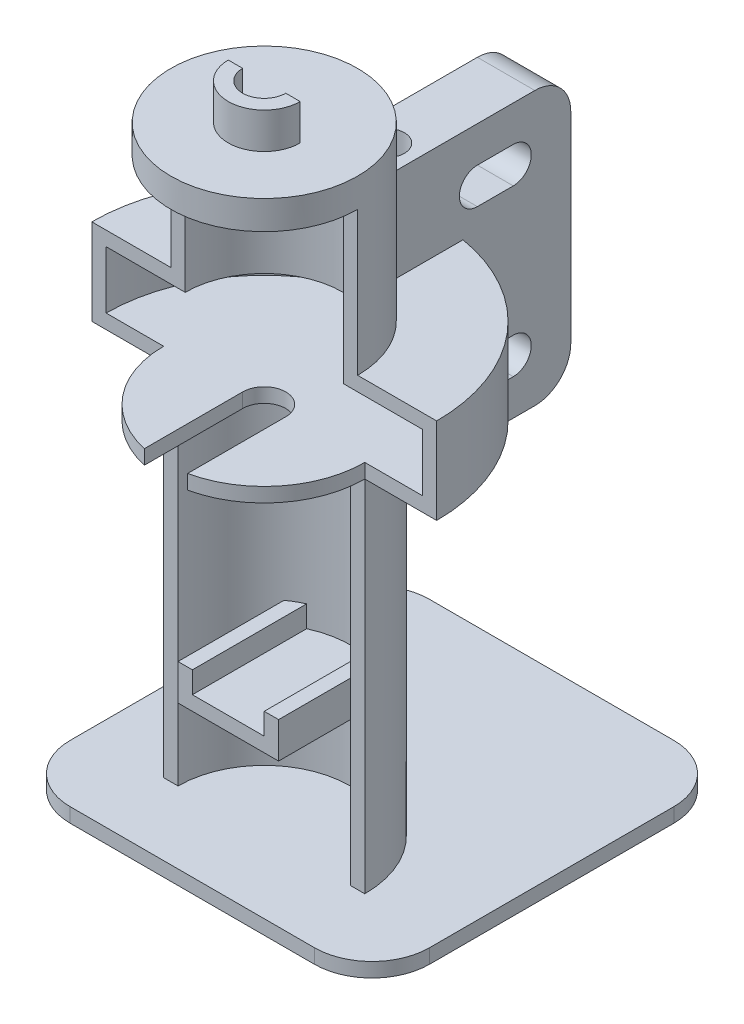
from build123d import *

# Parameters (mm, degrees)
MOTOR_FRONTPLATE_DEPTH           = 2
MOTORKRYBBE_START                = 50
MOTORKRYBBE_DEPTH                = 50
SKYGGE_KAPPE_DEPTH               = 8
SKYGGE_TOPP_DEPTH                = 2
LEDHOLDER_TOPP_DEPTH             = 13
LEDHOLDER_START                  = 13
LEDHOLDER_BUNN_DEPTH             = 13
SKETCH10_R                       = 2.5
LEDHULL_DEPTH                    = 51.950956811
ROTORKAPPE_VEGG_DEPTH            = 20
SKETCH12_R                       = 13
LASERHOLDER_DEPTH                = 4
LASER_HULL_D                     = 6
BUNNPLATE_DEPTH                  = 2
BOSS_EXTRUDE12_DEPTH             = 5
BOSS_EXTRUDE12_DIRECTION_2_REACH = 72.207
LED_START                        = -38
LED_KABELHOLDER_DEPTH            = 38
KABELHOLDER_HULL_REACH           = 73.729
FILLET1_R                        = 5
BOSS_EXTRUDE14_DEPTH             = 5


with BuildPart() as part:
    # Sketch1 → Motor-frontplate (new body)
    with BuildSketch(Plane(origin=(0, 0, 0), x_dir=(1, 0, 0), z_dir=(0, 1, 0))):
        with BuildLine():
            ThreePointArc((-3, 0), (0, 3), (3, 0))
            Line((3, 0), (3, -13.674794331))
            ThreePointArc((3, -13.674794331), (10.908712115, -8.774964387), (14, 0))
            ThreePointArc((14, 0), (0, 14), (-14, 0))
            ThreePointArc((-14, 0), (-10.908712115, -8.774964387), (-3, -13.674794331))
            Line((-3, -13.674794331), (-3, 0))
        make_face()
        with BuildLine():
            Line((14, 0), (24, 0))
            ThreePointArc((24, 0), (0, 24), (-24, 0))
            Line((-24, 0), (-14, 0))
            ThreePointArc((-14, 0), (0, 14), (14, 0))
        make_face()
    extrude(amount=MOTOR_FRONTPLATE_DEPTH)

    # Sketch2 → Motorkrybbe (add)
    with BuildSketch(Plane.XZ.offset(MOTORKRYBBE_START)):
        with BuildLine():
            Line((-12, 0), (-14, 0))
            ThreePointArc((-14, 0), (0, -14), (14, 0))
            Line((14, 0), (12, 0))
            ThreePointArc((12, 0), (0, -12), (-12, 0))
        make_face()
    extrude(amount=-MOTORKRYBBE_DEPTH)

    # Sketch5 → Skygge - Kappe (add)
    with BuildSketch(Plane(origin=(0, 2, 0), x_dir=(1, 0, 0), z_dir=(0, 1, 0))):
        with BuildLine():
            Line((-24, 0), (-22, 0))
            ThreePointArc((-22, 0), (0, 22), (22, 0))
            Line((22, 0), (24, 0))
            ThreePointArc((24, 0), (0, 24), (-24, 0))
        make_face()
    extrude(amount=SKYGGE_KAPPE_DEPTH)

    # Sketch6 → Skygge - Topp (add)
    with BuildSketch(Plane(origin=(0, 10, 0), x_dir=(1, 0, 0), z_dir=(0, 1, 0))):
        with BuildLine():
            Line((-24, 0), (-11, 0))
            ThreePointArc((-11, 0), (0, 11), (11, 0))
            Line((11, 0), (24, 0))
            ThreePointArc((24, 0), (0, 24), (-24, 0))
        make_face()
    extrude(amount=SKYGGE_TOPP_DEPTH)

    # Sketch7 → LEDholder - Topp (add)
    with BuildSketch(Plane(origin=(0, 12, 0), x_dir=(1, 0, 0), z_dir=(0, 1, 0))):
        with BuildLine():
            Line((-4, 12.369316877), (-4, 23.664319132))
            ThreePointArc((-4, 23.664319132), (0, 24), (4, 23.664319132))
            Line((4, 23.664319132), (4, 12.369316877))
            ThreePointArc((4, 12.369316877), (0, 13), (-4, 12.369316877))
        make_face()
    extrude(amount=LEDHOLDER_TOPP_DEPTH)

    # Sketch8 → LEDholder - Bunn (add)
    with BuildSketch(Plane.XZ.offset(LEDHOLDER_START)):
        with BuildLine():
            ThreePointArc((-4, -23.664319132), (0, -24), (4, -23.664319132))
            Line((4, -23.664319132), (4, -13.416407865))
            ThreePointArc((4, -13.416407865), (0, -14), (-4, -13.416407865))
            Line((-4, -13.416407865), (-4, -23.664319132))
        make_face()
    extrude(amount=-LEDHOLDER_BUNN_DEPTH)

    # Sketch10 → LEDhull (cut, through all)
    with BuildSketch(Plane.XZ.offset(13)):
        with Locations(Location((0, -17, 0), (0, 0, 270))):
            Circle(SKETCH10_R)
    extrude(amount=-LEDHULL_DEPTH, mode=Mode.SUBTRACT)

    # Sketch11 → Rotorkappe - Vegg (add)
    with BuildSketch(Plane(origin=(0, 12, 0), x_dir=(1, 0, 0), z_dir=(0, 1, 0))):
        with BuildLine():
            Line((-13, 0), (-11, 0))
            ThreePointArc((-11, 0), (0, 11), (11, 0))
            Line((11, 0), (13, 0))
            ThreePointArc((13, 0), (0, 13), (-13, 0))
        make_face()
    extrude(amount=ROTORKAPPE_VEGG_DEPTH)

    # Sketch12 → Laserholder (add)
    with BuildSketch(Plane(origin=(0, 32, 0), x_dir=(1, 0, 0), z_dir=(0, 1, 0))):
        with Locations(Location((0, 0, 0), (0, 0, 107.920213139))):
            Circle(SKETCH12_R)
    extrude(amount=LASERHOLDER_DEPTH)

    # Laser - hull (through all)
    with Locations(Plane(origin=(0, 36, 0), x_dir=(1, 0, 0), z_dir=(0, 1, 0))):
        with Locations((0, 0)):
            Hole(LASER_HULL_D / 2)

    # Sketch16 → Bunnplate (add)
    with BuildSketch(Plane.XZ.offset(50)):
        with BuildLine():
            Line((-17, -40), (17, -40))
            ThreePointArc((17, -40), (22.656854249, -37.656854249), (25, -32))
            Line((25, -32), (25, 2))
            ThreePointArc((25, 2), (22.656854249, 7.656854249), (17, 10))
            Line((17, 10), (-17, 10))
            ThreePointArc((-17, 10), (-22.656854249, 7.656854249), (-25, 2))
            Line((-25, 2), (-25, -32))
            ThreePointArc((-25, -32), (-22.656854249, -37.656854249), (-17, -40))
        make_face()
    extrude(amount=BUNNPLATE_DEPTH)

    # Sketch19 → Boss-Extrude12 (add)
    with BuildSketch(Plane.XY):
        Polygon((0, -33), (-5, -33), (-5, -30), (-7, -30), (-7, -35), (0, -35), align=None)
    boss_extrude12 = extrude(amount=BOSS_EXTRUDE12_DEPTH)

    # Sketch19 → Boss-Extrude12 direction 2 (add, up to next)
    with BuildSketch(Plane.XY, mode=Mode.PRIVATE) as boss_extrude12_direction_2_sk1:
        Polygon((0, -33), (-5, -33), (-5, -30), (-7, -30), (-7, -35), (0, -35), align=None)
    boss_extrude12_direction_2_tool1 = extrude(boss_extrude12_direction_2_sk1.sketch, amount=-BOSS_EXTRUDE12_DIRECTION_2_REACH, mode=Mode.PRIVATE) - part.part
    boss_extrude12_direction_2 = boss_extrude12_direction_2_tool1.solids().sort_by_distance((-4.25, -33.25, 0))[0]
    add(boss_extrude12_direction_2)

    # Mirror2: Boss-Extrude12, Boss-Extrude12 direction 2 across plane
    add(boss_extrude12.mirror(Plane(origin=(0, -35, -40.002), x_dir=(0, 0, 1), z_dir=(1, 0, 0))))
    add(boss_extrude12_direction_2.mirror(Plane(origin=(0, -35, -40.002), x_dir=(0, 0, 1), z_dir=(1, 0, 0))))

    # Sketch20 → LED - kabelholder (add)
    with BuildSketch(Plane(origin=(0, 25, 0), x_dir=(1, 0, 0), z_dir=(0, 1, 0)).offset(LED_START)):
        with BuildLine():
            Line((4, 23.664319132), (4, 38.664319132))
            Line((4, 38.664319132), (-4, 38.664319132))
            Line((-4, 38.664319132), (-4, 23.664319132))
            ThreePointArc((-4, 23.664319132), (0, 24), (4, 23.664319132))
        make_face()
    extrude(amount=LED_KABELHOLDER_DEPTH)

    # Sketch21 → Kabelholder - hull (cut, up to next)
    with BuildSketch(Plane(origin=(4, 0, 0), x_dir=(0, 0, -1), z_dir=(1, 0, 0)), mode=Mode.PRIVATE) as kabelholder_hull_sk1:
        with BuildLine():
            Line((25.664319132, 15), (30.664319132, 15))
            ThreePointArc((30.664319132, 15), (33.164319132, 17.5), (30.664319132, 20))
            Line((30.664319132, 20), (25.664319132, 20))
            ThreePointArc((25.664319132, 20), (23.164319132, 17.5), (25.664319132, 15))
        make_face()
    kabelholder_hull_tool1 = extrude(kabelholder_hull_sk1.sketch, amount=-KABELHOLDER_HULL_REACH, mode=Mode.PRIVATE) & part.part
    # Sketch21 → Kabelholder - hull (cut, up to next)
    with BuildSketch(Plane(origin=(4, 0, 0), x_dir=(0, 0, -1), z_dir=(1, 0, 0)), mode=Mode.PRIVATE) as kabelholder_hull_sk2:
        with BuildLine():
            ThreePointArc((30.664319132, -3), (33.164319132, -5.5), (30.664319132, -8))
            Line((30.664319132, -8), (25.664319132, -8))
            ThreePointArc((25.664319132, -8), (23.164319132, -5.5), (25.664319132, -3))
            Line((25.664319132, -3), (30.664319132, -3))
        make_face()
    kabelholder_hull_tool2 = extrude(kabelholder_hull_sk2.sketch, amount=-KABELHOLDER_HULL_REACH, mode=Mode.PRIVATE) & part.part
    add(kabelholder_hull_tool1.solids().sort_by_distance((4, 17.5, -28.164319))[0], mode=Mode.SUBTRACT)
    add(kabelholder_hull_tool2.solids().sort_by_distance((4, -5.5, -28.164319))[0], mode=Mode.SUBTRACT)

    # Fillet1
    fillet1_edges = [part.edges().sort_by_distance(p)[0] for p in [
        (0, -13, -38.664319132),
        (0, 25, -38.664319132),
    ]]
    fillet(fillet1_edges, radius=FILLET1_R)

    # Sketch22 → Boss-Extrude14 (add)
    with BuildSketch(Plane(origin=(0, 36, 0), x_dir=(1, 0, 0), z_dir=(0, 1, 0))):
        with BuildLine():
            Line((-3, 0), (-5, 0))
            ThreePointArc((-5, 0), (0, -5), (5, 0))
            Line((5, 0), (3, 0))
            ThreePointArc((3, 0), (0, -3), (-3, 0))
        make_face()
    extrude(amount=BOSS_EXTRUDE14_DEPTH)


solid = part.part
